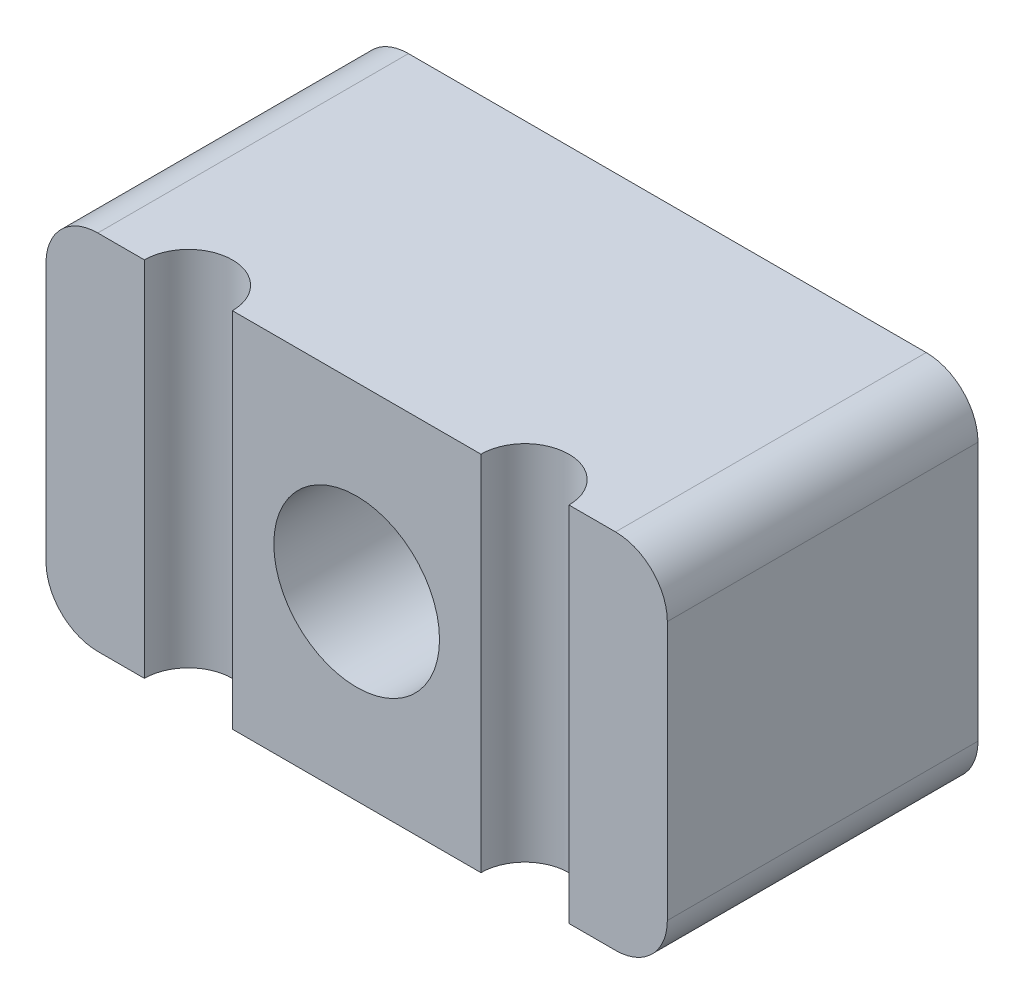
from build123d import *

# Parameters (mm, degrees)
SKETCH1_R           = 1.6
BOSS_EXTRUDE1_DEPTH = 6
CUT_EXTRUDE1_DEPTH  = 7


with BuildPart() as part:
    # Sketch1 → Boss-Extrude1 (new body)
    with BuildSketch(Plane.XY):
        with BuildLine():
            Line((12, 6), (12, 1))
            ThreePointArc((12, 1), (11.707106781, 0.292893219), (11, 0))
            Line((11, 0), (1, 0))
            ThreePointArc((1, 0), (0.292893219, 0.292893219), (0, 1))
            Line((0, 1), (0, 6))
            ThreePointArc((0, 6), (0.292893219, 6.707106781), (1, 7))
            Line((1, 7), (11, 7))
            ThreePointArc((11, 7), (11.707106781, 6.707106781), (12, 6))
        make_face()
        with Locations((6, 3.5)):
            Circle(SKETCH1_R, mode=Mode.SUBTRACT)
    extrude(amount=BOSS_EXTRUDE1_DEPTH)

    # Sketch2 → Cut-Extrude1 (cut)
    with BuildSketch(Plane.XZ):
        with BuildLine():
            Line((1.9, 6), (3.6, 6))
            ThreePointArc((3.6, 6), (2.75, 5.15), (1.9, 6))
        make_face()
        with BuildLine():
            Line((8.4, 6), (10.1, 6))
            ThreePointArc((10.1, 6), (9.25, 5.15), (8.4, 6))
        make_face()
    extrude(amount=-CUT_EXTRUDE1_DEPTH, mode=Mode.SUBTRACT)


solid = part.part
